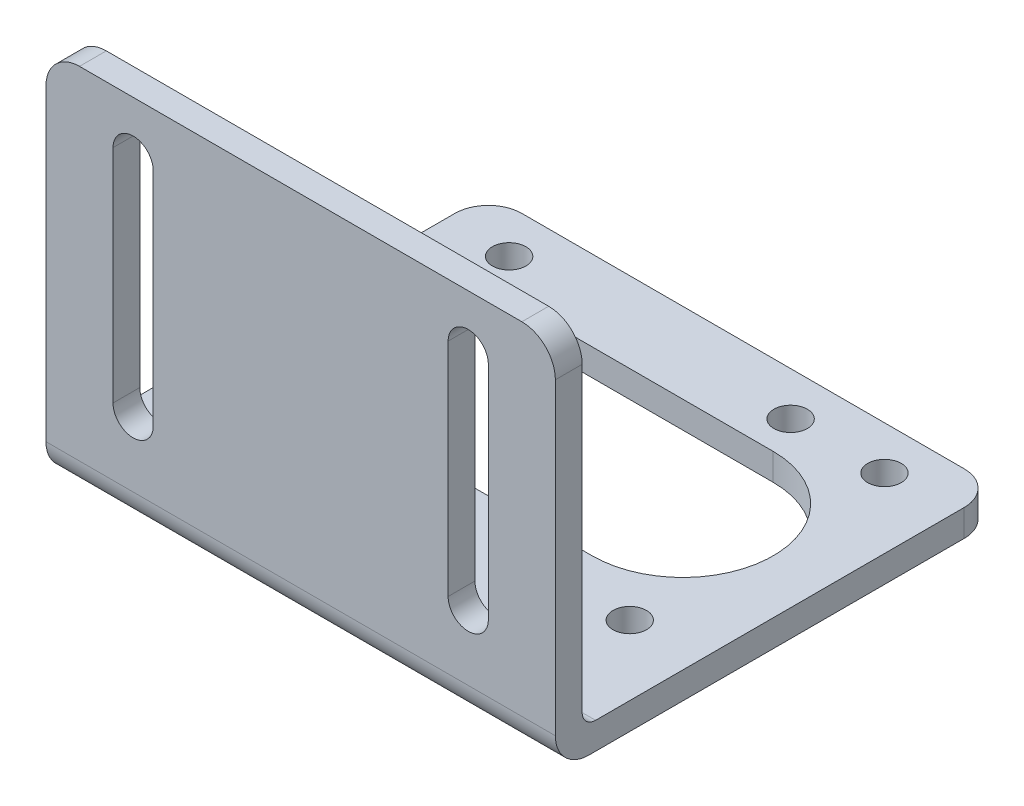
from build123d import *

# Parameters (mm, degrees)
SKETCH1_W           = 4
SKETCH1_H           = 52
SKETCH1_H_2         = 4
SKETCH1_W_2         = 62
BOSS_EXTRUDE1_DEPTH = 76
SKETCH2_R           = 2.5
CUT_EXTRUDE1_DEPTH  = 116.1868048
CUT_EXTRUDE2_DEPTH  = 116.1868048
FILLET1_R           = 5
FILLET2_R           = 2


with BuildPart() as part:
    # Sketch1 → Boss-Extrude1 (new body)
    with BuildSketch(Plane(origin=(0, 0, 0), x_dir=(0, 0, -1), z_dir=(1, 0, 0))):
        with Locations((2, 30)):
            Rectangle(SKETCH1_W, SKETCH1_H)
        with Locations((2, 2)):
            Rectangle(SKETCH1_W, SKETCH1_H_2)
        with Locations((35, 2)):
            Rectangle(SKETCH1_W_2, SKETCH1_H_2)
    extrude(amount=BOSS_EXTRUDE1_DEPTH)

    # Sketch2 → Cut-Extrude1 (cut, through all)
    with BuildSketch(Plane.XZ):
        with Locations(Location((9.6, -59.5, 0), (0, 0, 270))):
            Circle(SKETCH2_R)
        with Locations(Location((9.6, -21.5, 0), (0, 0, 270))):
            Circle(SKETCH2_R)
        with Locations(Location((23.6, -21.5, 0), (0, 0, 270))):
            Circle(SKETCH2_R)
        with Locations(Location((65.6, -21.5, 0), (0, 0, 270))):
            Circle(SKETCH2_R)
        with Locations(Location((65.6, -59.5, 0), (0, 0, 270))):
            Circle(SKETCH2_R)
        with Locations(Location((51.6, -59.5, 0), (0, 0, 270))):
            Circle(SKETCH2_R)
        with BuildLine():
            Line((54.5, -54), (21.5, -54))
            ThreePointArc((21.5, -54), (8, -40.5), (21.5, -27))
            Line((21.5, -27), (54.5, -27))
            ThreePointArc((54.5, -27), (68, -40.5), (54.5, -54))
        make_face()
    extrude(amount=-CUT_EXTRUDE1_DEPTH, mode=Mode.SUBTRACT)

    # Sketch3 → Cut-Extrude2 (cut, through all)
    with BuildSketch(Plane.XY):
        with BuildLine():
            Line((16, 48), (16, 15))
            ThreePointArc((16, 15), (13, 12), (10, 15))
            Line((10, 15), (10, 48))
            ThreePointArc((10, 48), (13, 51), (16, 48))
        make_face()
        with BuildLine():
            Line((60, 48), (60, 15))
            ThreePointArc((60, 15), (63, 12), (66, 15))
            Line((66, 15), (66, 48))
            ThreePointArc((66, 48), (63, 51), (60, 48))
        make_face()
    extrude(amount=-CUT_EXTRUDE2_DEPTH, mode=Mode.SUBTRACT)

    # Fillet1
    fillet1_edges = [part.edges().sort_by_distance(p)[0] for p in [
        (38, 0, 0),
        (76, 2, -66),
        (76, 56, -2),
        (0, 56, -2),
        (0, 2, -66),
    ]]
    fillet(fillet1_edges, radius=FILLET1_R)

    # Fillet2
    fillet2_edges = [part.edges().sort_by_distance(p)[0] for p in [
        (38, 4, -4),
    ]]
    fillet(fillet2_edges, radius=FILLET2_R)


solid = part.part
